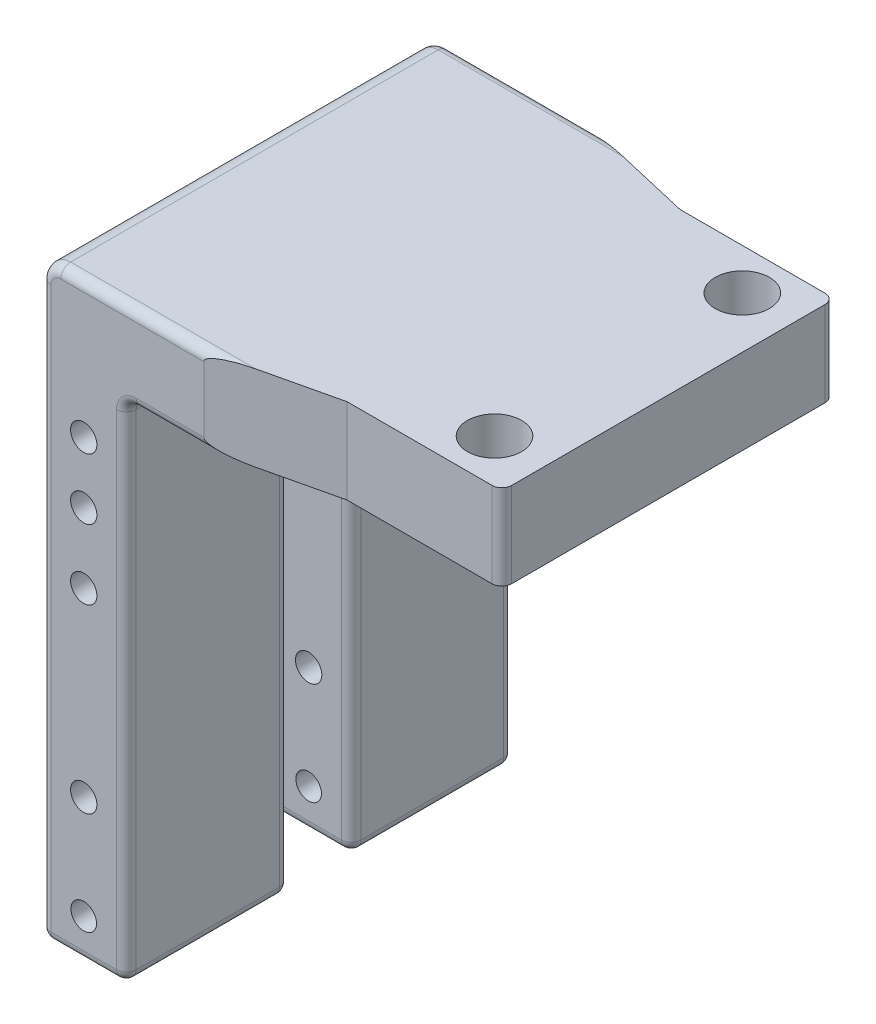
from build123d import *

# Parameters (mm, degrees)
BOSS_EXTRUDE1_DEPTH = 11
SKETCH3_R           = 3.5
CUT_EXTRUDE1_DEPTH  = 13
BOSS_EXTRUDE2_DEPTH = 11
SKETCH6_R           = 1.7
CUT_EXTRUDE2_DEPTH  = 50.8
FILLET1_R           = 2.54
FILLET2_R           = 1.27
FILLET3_R           = 1.27
FILLET4_R           = 1.27
FILLET5_R           = 1.27
FILLET6_R           = 1.27
FILLET7_R           = 1.27
SKETCH7_R           = 1.651
SKETCH7_R_2         = 1.7
CUT_EXTRUDE3_DEPTH  = 60.96
FILLET8_R           = 1.27


with BuildPart() as part:
    # Sketch2 → Boss-Extrude1 (new body)
    with BuildSketch(Plane(origin=(0, 0, 0), x_dir=(1, 0, 0), z_dir=(0, 1, 0))):
        Polygon((0, 43), (0, 0), (-20, 0), (-35, -3.5), (-45, -3.5), (-45, 46.5), (-35, 46.5), (-20, 43), align=None)
    extrude(amount=BOSS_EXTRUDE1_DEPTH)

    # Sketch3 → Cut-Extrude1 (cut)
    with BuildSketch(Plane.XZ):
        with Locations(Location((-6.632378844, -5.680552133, 0), (0, 0, 270))):
            Circle(SKETCH3_R)
        with Locations(Location((-6.631542689, -37.680552122, 0), (0, 0, 270))):
            Circle(SKETCH3_R)
    extrude(amount=-CUT_EXTRUDE1_DEPTH, mode=Mode.SUBTRACT)

    # Sketch5 → Boss-Extrude2 (add)
    with BuildSketch(Plane.ZY.offset(45)):
        Polygon((3.5, 11), (3.5, -65.2), (-17.545, -65.2), (-17.545, -2.725115984), (-25.545, -2.725115984), (-25.545, -65.2), (-46.5, -65.2), (-46.5, 11), align=None)
    extrude(amount=BOSS_EXTRUDE2_DEPTH)

    # Sketch6 → Cut-Extrude2 (cut)
    with BuildSketch(Plane(origin=(0, 0, -46.5), x_dir=(-1, 0, 0), z_dir=(0, 0, -1))):
        with Locations(Location((50.5, -6.479893852, 0), (0, 0, 270))):
            Circle(SKETCH6_R)
        with Locations(Location((50.5, -23.36828279, 0), (0, 0, 270))):
            Circle(SKETCH6_R)
        with Locations(Location((50.5, -14.35419589, 0), (0, 0, 270))):
            Circle(SKETCH6_R)
    extrude(amount=-CUT_EXTRUDE2_DEPTH, mode=Mode.SUBTRACT)

    # Fillet1
    fillet1_edges = [part.edges().sort_by_distance(p)[0] for p in [
        (-56, 11, -21.5),
    ]]
    fillet(fillet1_edges, radius=FILLET1_R)

    # Fillet2
    fillet2_edges = [part.edges().sort_by_distance(p)[0] for p in [
        (-45, 0, -21.5),
    ]]
    fillet(fillet2_edges, radius=FILLET2_R)

    # Fillet3
    fillet3_edges = [part.edges().sort_by_distance(p)[0] for p in [
        (0, 5.5, 0),
    ]]
    fillet(fillet3_edges, radius=FILLET3_R)

    # Fillet4
    fillet4_edges = [part.edges().sort_by_distance(p)[0] for p in [
        (0, 5.5, -43),
    ]]
    fillet(fillet4_edges, radius=FILLET4_R)

    # Fillet5
    fillet5_edges = [part.edges().sort_by_distance(p)[0] for p in [
        (-50.5, -65.2, -25.545),
        (-50.5, -65.2, -17.545),
    ]]
    fillet(fillet5_edges, radius=FILLET5_R)

    # Fillet6
    fillet6_edges = [part.edges().sort_by_distance(p)[0] for p in [
        (-56, -65.2, -6.3875),
        (-56, -33.327557992, -25.545),
        (-56, -64.828025612, -25.916974388),
        (-56, -64.828025612, -17.173025612),
        (-56, -65.2, -36.6575),
        (-56, -33.327557992, -17.545),
    ]]
    fillet(fillet6_edges, radius=FILLET6_R)

    # Fillet7
    fillet7_edges = [part.edges().sort_by_distance(p)[0] for p in [
        (-56, -27.735, 3.5),
        (-49.865, -65.2, 3.5),
        (-55.628025612, -64.828025612, 3.5),
        (-49.865, -65.2, -46.5),
        (-55.628025612, -64.828025612, -46.5),
        (-44.23, 11, 3.5),
        (-56, -27.735, -46.5),
        (-44.23, 11, -46.5),
        (-55.256051224, 10.256051224, -46.5),
        (-55.256051224, 10.256051224, 3.5),
    ]]
    fillet(fillet7_edges, radius=FILLET7_R)

    # Sketch7 → Cut-Extrude3 (cut)
    with BuildSketch(Plane(origin=(0, 0, -46.5), x_dir=(-1, 0, 0), z_dir=(0, 0, -1))):
        with Locations((50.5, -60.041602357)):
            Circle(SKETCH7_R)
        with Locations((50.5, -46.740028499)):
            Circle(SKETCH7_R_2)
    extrude(amount=-CUT_EXTRUDE3_DEPTH, mode=Mode.SUBTRACT)

    # Fillet8
    fillet8_edges = [part.edges().sort_by_distance(p)[0] for p in [
        (-45, -65.2, -7.0225),
        (-45, -33.327557992, -25.545),
        (-45, -64.828025612, -25.916974388),
        (-45, -64.828025612, -17.173025612),
        (-45, -65.2, -36.0225),
        (-45, -32.6, 3.5),
        (-45, -64.828025612, 3.128025612),
        (-45, -64.828025612, -46.128025612),
        (-45, -33.327557992, -17.545),
        (-39.365, 0, 3.5),
        (-39.365, 0, -46.5),
        (-45, -32.6, -46.5),
        (-44.628025612, -0.371974388, -46.5),
        (-44.628025612, -0.371974388, 3.5),
    ]]
    fillet(fillet8_edges, radius=FILLET8_R)


solid = part.part
